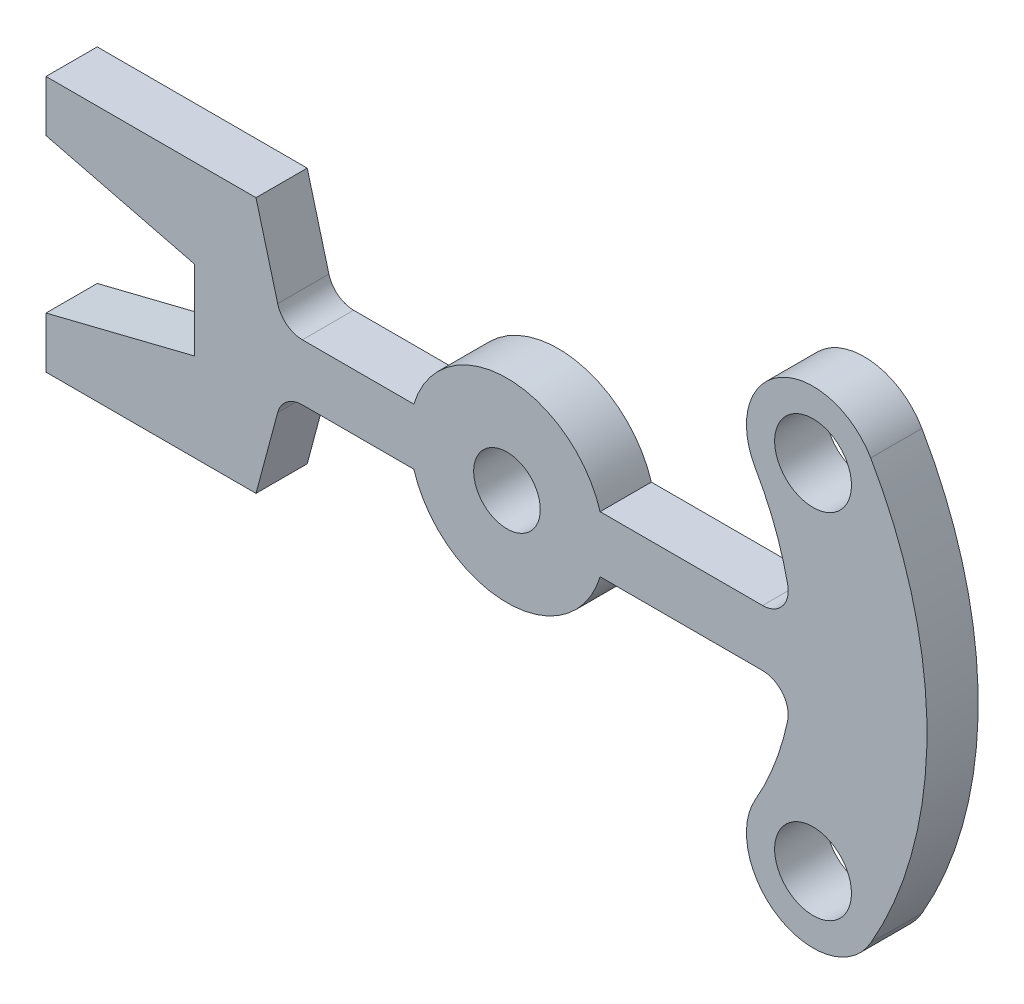
from build123d import *

# Parameters (mm, degrees)
SKETCH1_R           = 6.5
SKETCH1_R_2         = 7.5
BOSS_EXTRUDE1_DEPTH = 10


with BuildPart() as part:
    # Sketch1 → Boss-Extrude1 (new body)
    with BuildSketch(Plane.XY):
        with BuildLine():
            Line((-90, 25), (-90, 15))
            Line((-90, 15), (-61, 7.769487918))
            Line((-61, 7.769487918), (-61, -7.769487918))
            Line((-61, -7.769487918), (-90, -15))
            Line((-90, -15), (-90, -25))
            Line((-90, -25), (-49, -25))
            Line((-49, -25), (-44.767984939, -9.205904774))
            ThreePointArc((-44.767984939, -9.205904774), (-42.982162953, -6.533233299), (-39.938355808, -5.5))
            Line((-39.938355808, -5.5), (-18.186533479, -5.5))
            ThreePointArc((-18.186533479, -5.5), (0, -19), (18.186533479, -5.5))
            Line((18.186533479, -5.5), (49.907414279, -5.5))
            ThreePointArc((49.907414279, -5.5), (53.789878627, -7.349369811), (54.800298032, -11.529411765))
            ThreePointArc((54.800298032, -11.529411765), (52.301289102, -20.014373791), (48.497422612, -28))
            ThreePointArc((48.497422612, -28), (53.255752861, -45.758330249), (71.01408311, -41))
            ThreePointArc((71.01408311, -41), (82, 0), (71.01408311, 41))
            ThreePointArc((71.01408311, 41), (53.255752861, 45.758330249), (48.497422612, 28))
            ThreePointArc((48.497422612, 28), (52.301289102, 20.014373791), (54.800298032, 11.529411765))
            ThreePointArc((54.800298032, 11.529411765), (53.789878627, 7.349369811), (49.907414279, 5.5))
            Line((49.907414279, 5.5), (18.186533479, 5.5))
            ThreePointArc((18.186533479, 5.5), (0, 19), (-18.186533479, 5.5))
            Line((-18.186533479, 5.5), (-39.938355808, 5.5))
            ThreePointArc((-39.938355808, 5.5), (-42.982162953, 6.533233299), (-44.767984939, 9.205904774))
            Line((-44.767984939, 9.205904774), (-49, 25))
            Line((-49, 25), (-90, 25))
        make_face()
        Circle(SKETCH1_R, mode=Mode.SUBTRACT)
        with Locations((59.755752861, 34.5)):
            Circle(SKETCH1_R_2, mode=Mode.SUBTRACT)
        with Locations((59.755752861, -34.5)):
            Circle(SKETCH1_R_2, mode=Mode.SUBTRACT)
    extrude(amount=BOSS_EXTRUDE1_DEPTH)


solid = part.part
